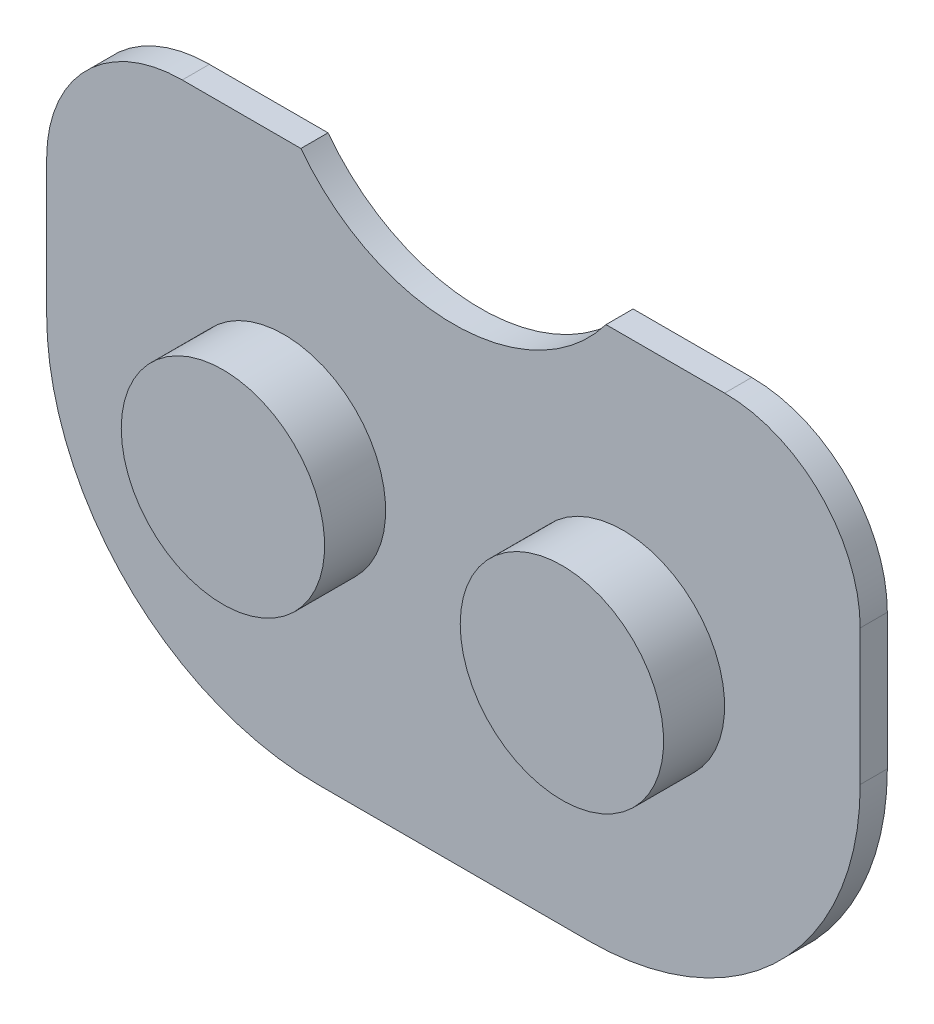
from build123d import *

# Parameters (mm, degrees)
EXTRUDE_1_DEPTH = 2
SKETCH_3_R      = 7.5
EXTRUDE_2_DEPTH = 6.5


with BuildPart() as part:
    # 草图1 → 凸台-拉伸1 (new body)
    with BuildSketch(Plane.XY):
        with BuildLine():
            Line((-10, -20), (10, -20))
            ThreePointArc((10, -20), (24.142135624, -14.142135624), (30, 0))
            Line((30, 0), (30, 10))
            ThreePointArc((30, 10), (27.071067812, 17.071067812), (20, 20))
            Line((20, 20), (11.249888888, 20))
            ThreePointArc((11.249888888, 20), (0, 14.4), (-11.249888888, 20))
            Line((-11.249888888, 20), (-20, 20))
            ThreePointArc((-20, 20), (-27.071067812, 17.071067812), (-30, 10))
            Line((-30, 10), (-30, 0))
            ThreePointArc((-30, 0), (-24.142135624, -14.142135624), (-10, -20))
        make_face()
    extrude(amount=EXTRUDE_1_DEPTH)

    # 草图3 → 凸台-拉伸2 (add)
    with BuildSketch(Plane.XY):
        with Locations(Location((-12.5, 0, 0), (0, 0, 180))):
            Circle(SKETCH_3_R)
        with Locations(Location((12.5, 0, 0), (0, 0, 180))):
            Circle(SKETCH_3_R)
    extrude(amount=EXTRUDE_2_DEPTH)


solid = part.part
